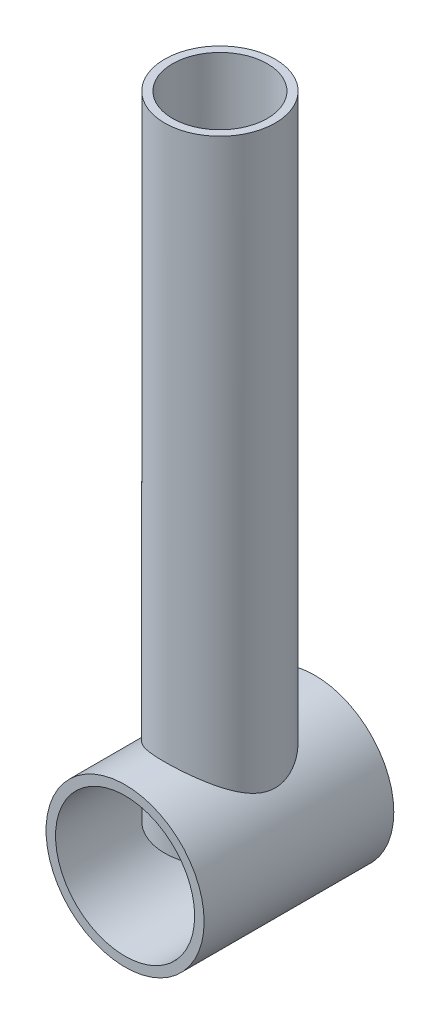
from build123d import *

# Parameters (mm, degrees)
IZIM1_R                          = 17.5
IZIM1_R_2                        = 15
Y_KSEKLIK_EKSTR_ZYON1_DEPTH      = 200
Y_KSEKLIK_EKSTR_ZYON2_DEPTH      = 30
Y_KSEKLIK_EKSTR_ZYON2_DEPTH_BACK = 30
IZIM2_R                          = 25
IZIM2_R_2                        = 22


with BuildPart() as part:
    # Çizim1 → Yükseklik-Ekstrüzyon1 (new body)
    with BuildSketch(Plane(origin=(0, 0, 0), x_dir=(1, 0, 0), z_dir=(0, 1, 0))):
        Circle(IZIM1_R)
        Circle(IZIM1_R_2, mode=Mode.SUBTRACT)
    extrude(amount=Y_KSEKLIK_EKSTR_ZYON1_DEPTH)

    # Çizim2 → Yükseklik-Ekstrüzyon2 (add, two sides: drawn at the far end of the back side and taken through both)
    with BuildSketch(Plane.XY.offset(-Y_KSEKLIK_EKSTR_ZYON2_DEPTH_BACK)):
        Circle(IZIM2_R)
        Circle(IZIM2_R_2, mode=Mode.SUBTRACT)
    extrude(amount=Y_KSEKLIK_EKSTR_ZYON2_DEPTH + Y_KSEKLIK_EKSTR_ZYON2_DEPTH_BACK)


solid = part.part
